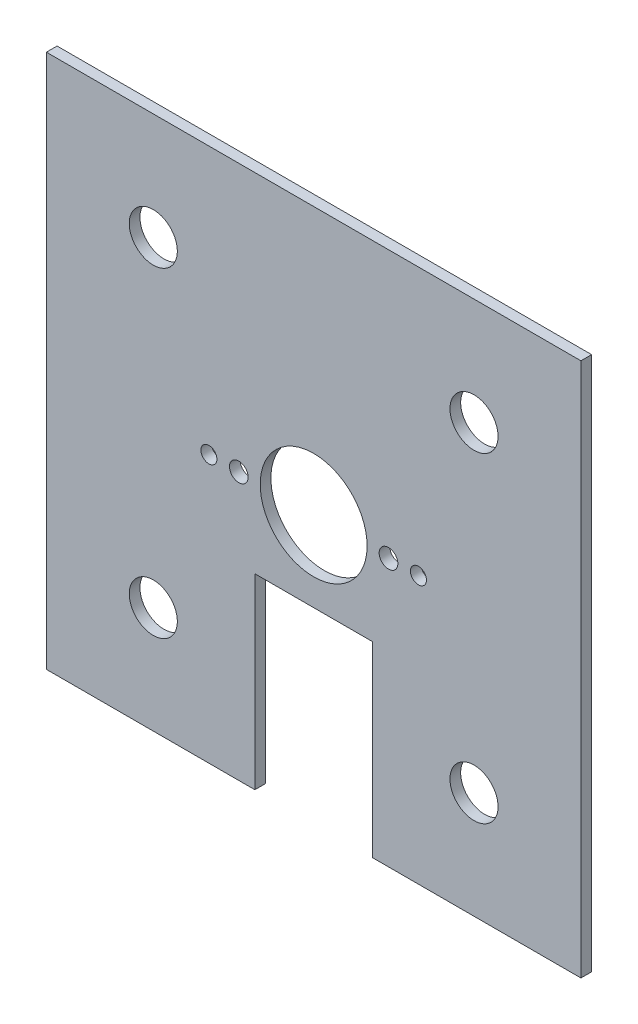
from build123d import *

# Parameters (mm, degrees)
SKETCH1_R           = 2.25
SKETCH1_R_2         = 5
SKETCH1_R_3         = 0.75
SKETCH1_R_4         = 0.875
BOSS_EXTRUDE1_DEPTH = 1


with BuildPart() as part:
    # Sketch1 → Boss-Extrude1 (new body)
    with BuildSketch(Plane.XY):
        Polygon((-25, 25), (-25, -25), (-5.5, -25), (-5.5, -7.5), (5.5, -7.5), (5.5, -25), (25, -25), (25, 25), align=None)
        with Locations((-15, -15)):
            Circle(SKETCH1_R, mode=Mode.SUBTRACT)
        Circle(SKETCH1_R_2, mode=Mode.SUBTRACT)
        with Locations((15, -15)):
            Circle(SKETCH1_R, mode=Mode.SUBTRACT)
        with Locations((-9.8, 0)):
            Circle(SKETCH1_R_3, mode=Mode.SUBTRACT)
        with Locations((-7, 0)):
            Circle(SKETCH1_R_4, mode=Mode.SUBTRACT)
        with Locations((-15, 15)):
            Circle(SKETCH1_R, mode=Mode.SUBTRACT)
        with Locations((7, 0)):
            Circle(SKETCH1_R_4, mode=Mode.SUBTRACT)
        with Locations((9.8, 0)):
            Circle(SKETCH1_R_3, mode=Mode.SUBTRACT)
        with Locations((15, 15)):
            Circle(SKETCH1_R, mode=Mode.SUBTRACT)
    extrude(amount=BOSS_EXTRUDE1_DEPTH)


solid = part.part
